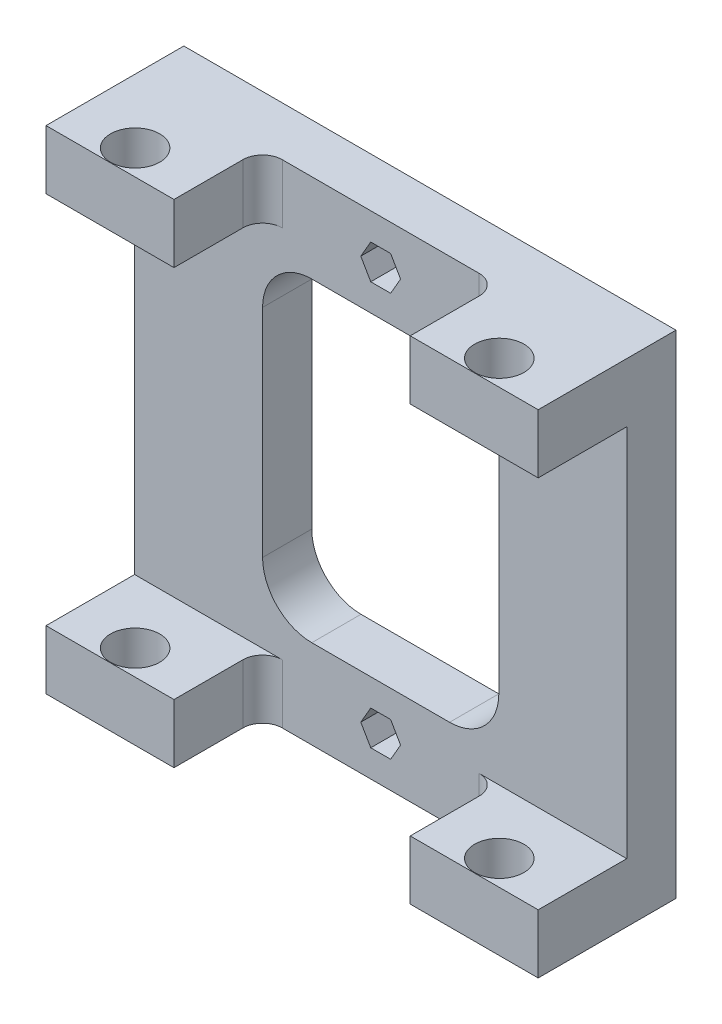
from build123d import *

# Parameters (mm, degrees)
CROQUIS1_W              = 50
CROQUIS1_H              = 50
SALIENTE_EXTRUIR1_DEPTH = 5
CROQUIS2_W              = 13
CROQUIS2_H              = 6
SALIENTE_EXTRUIR2_DEPTH = 9
CROQUIS3_R              = 2.5
CORTAR_EXTRUIR5_DEPTH   = 58.628118137
REDONDEO1_R             = 2
CORTAR_EXTRUIR6_DEPTH   = 4
CROQUIS5_R              = 1.5
CORTAR_EXTRUIR7_DEPTH   = 4


with BuildPart() as part:
    # Croquis1 → Saliente-Extruir1 (new body)
    with BuildSketch(Plane.XY):
        Rectangle(CROQUIS1_W, CROQUIS1_H)
        with BuildLine():
            Line((7, -16), (-7, -16))
            ThreePointArc((-7, -16), (-10.535533906, -14.535533906), (-12, -11))
            Line((-12, -11), (-12, 11))
            ThreePointArc((-12, 11), (-10.535533906, 14.535533906), (-7, 16))
            Line((-7, 16), (7, 16))
            ThreePointArc((7, 16), (10.535533906, 14.535533906), (12, 11))
            Line((12, 11), (12, -11))
            ThreePointArc((12, -11), (10.535533906, -14.535533906), (7, -16))
        make_face(mode=Mode.SUBTRACT)
    extrude(amount=SALIENTE_EXTRUIR1_DEPTH)

    # Croquis2 → Saliente-Extruir2 (add)
    with BuildSketch(Plane.XY.offset(5)):
        with Locations((18.5, 22)):
            Rectangle(CROQUIS2_W, CROQUIS2_H)
        with Locations((-18.5, 22)):
            Rectangle(CROQUIS2_W, CROQUIS2_H)
        with Locations((18.5, -22)):
            Rectangle(CROQUIS2_W, CROQUIS2_H)
        with Locations((-18.5, -22)):
            Rectangle(CROQUIS2_W, CROQUIS2_H)
    extrude(amount=SALIENTE_EXTRUIR2_DEPTH)

    # Croquis3 → Cortar-Extruir5 (cut, through all)
    with BuildSketch(Plane(origin=(0, 25, 0), x_dir=(1, 0, 0), z_dir=(0, 1, 0))):
        with Locations(Location((-18.5, -11.45, 0), (0, 0, 180))):
            Circle(CROQUIS3_R)
        with Locations(Location((18.5, -11.45, 0), (0, 0, 90))):
            Circle(CROQUIS3_R)
    extrude(amount=-CORTAR_EXTRUIR5_DEPTH, mode=Mode.SUBTRACT)

    # Redondeo1
    redondeo1_edges = [part.edges().sort_by_distance(p)[0] for p in [
        (-12, 22, 5),
        (12, 22, 5),
        (12, -22, 5),
        (-12, -22, 5),
    ]]
    fillet(redondeo1_edges, radius=REDONDEO1_R)

    # Croquis4 → Cortar-Extruir6 (cut)
    with BuildSketch(Plane.XY.offset(5)):
        Polygon((-1.010362971, 18.75), (1.010362971, 18.75), (2.020725942, 20.5), (1.010362971, 22.25), (-1.010362971, 22.25), (-2.020725942, 20.5), align=None)
        Polygon((-2.020725942, -20.5), (-1.010362971, -18.75), (1.010362971, -18.75), (2.020725942, -20.5), (1.010362971, -22.25), (-1.010362971, -22.25), align=None)
    extrude(amount=-CORTAR_EXTRUIR6_DEPTH, mode=Mode.SUBTRACT)

    # Croquis5 → Cortar-Extruir7 (cut)
    with BuildSketch(Plane.XY.offset(1)):
        with Locations((0, 20.5)):
            Circle(CROQUIS5_R)
        with Locations((0, -20.5)):
            Circle(CROQUIS5_R)
    extrude(amount=-CORTAR_EXTRUIR7_DEPTH, mode=Mode.SUBTRACT)


solid = part.part
